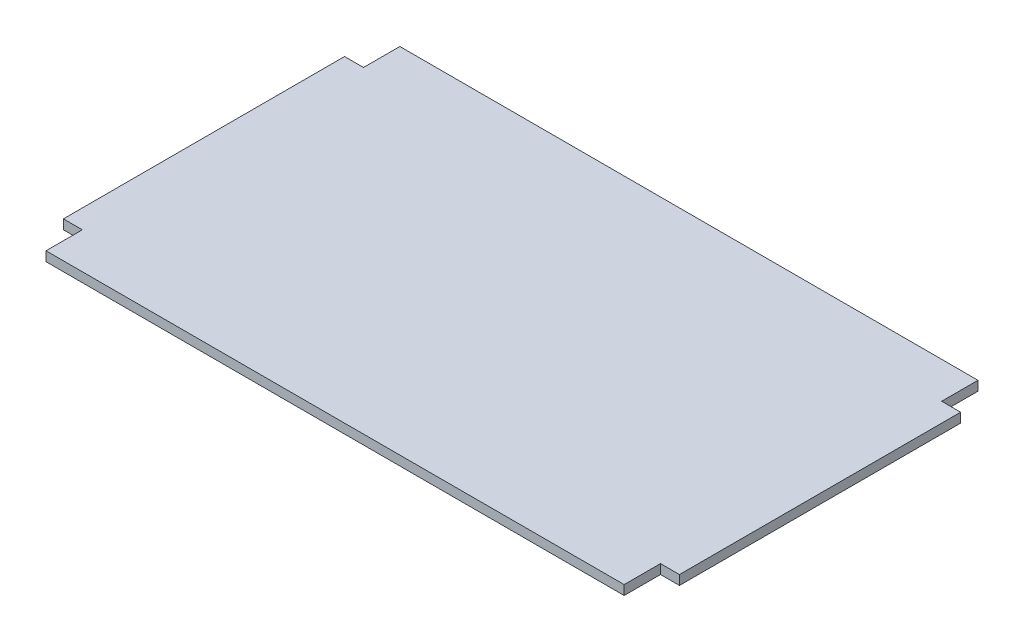
from build123d import *

# Parameters (mm, degrees)
BOSS_EXTRUDE1_DEPTH = 19.05


with BuildPart() as part:
    # Sketch1 → Boss-Extrude1 (new body)
    with BuildSketch(Plane(origin=(0, 0, 0), x_dir=(1, 0, 0), z_dir=(0, 1, 0))):
        Polygon((1238.25, 0), (1200.15, 0), (1200.15, 73.025), (38.1, 73.025), (38.1, 0), (0, 0), (0, -565.15), (38.1, -565.15), (38.1, -638.175), (1200.15, -638.175), (1200.15, -565.15), (1238.25, -565.15), align=None)
    extrude(amount=BOSS_EXTRUDE1_DEPTH)


solid = part.part
